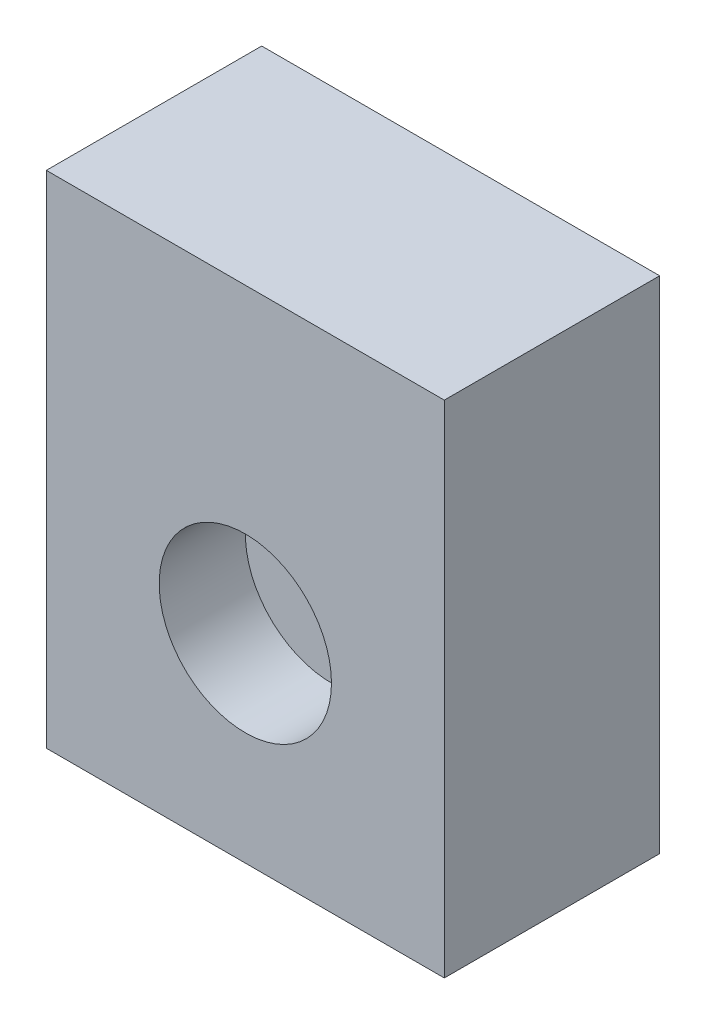
from build123d import *

# Parameters (mm, degrees)
SKETCH1_W           = 9.24
SKETCH1_H           = 11.62
BOSS_EXTRUDE1_DEPTH = 5
SKETCH2_R           = 2
CUT_EXTRUDE1_DEPTH  = 2


with BuildPart() as part:
    # Sketch1 → Boss-Extrude1 (new body)
    with BuildSketch(Plane.XY):
        Rectangle(SKETCH1_W, SKETCH1_H)
    extrude(amount=BOSS_EXTRUDE1_DEPTH)

    # Sketch2 → Cut-Extrude1 (cut)
    with BuildSketch(Plane.XY.offset(5)):
        with Locations((0, -1.19)):
            Circle(SKETCH2_R)
    extrude(amount=-CUT_EXTRUDE1_DEPTH, mode=Mode.SUBTRACT)


solid = part.part
